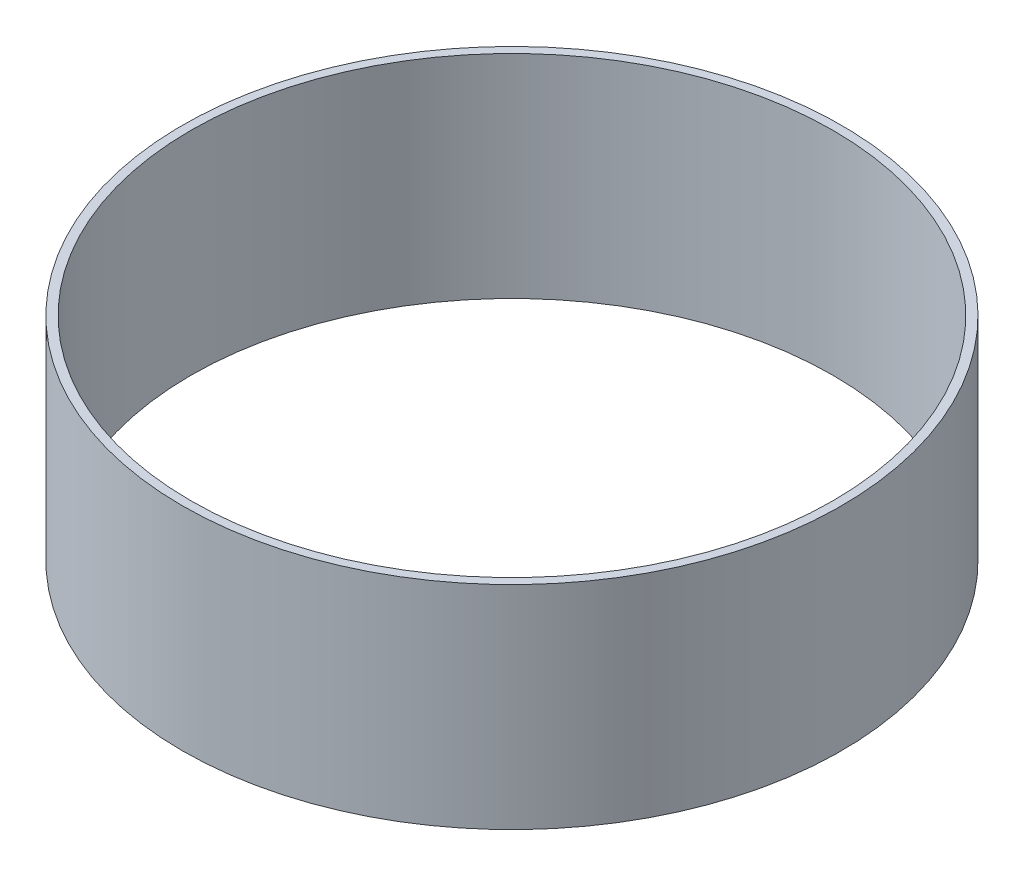
from build123d import *

# Parameters (mm, degrees)
SKETCH1_R           = 24.85
SKETCH1_R_2         = 24.2
BOSS_EXTRUDE1_DEPTH = 16


with BuildPart() as part:
    # Sketch1 → Boss-Extrude1 (new body)
    with BuildSketch(Plane(origin=(0, 0, 0), x_dir=(1, 0, 0), z_dir=(0, 1, 0))):
        with Locations(Location((0, 0, 0), (0, 0, 270))):
            Circle(SKETCH1_R)
        with Locations(Location((0, 0, 0), (0, 0, 270))):
            Circle(SKETCH1_R_2, mode=Mode.SUBTRACT)
    extrude(amount=BOSS_EXTRUDE1_DEPTH)


solid = part.part
